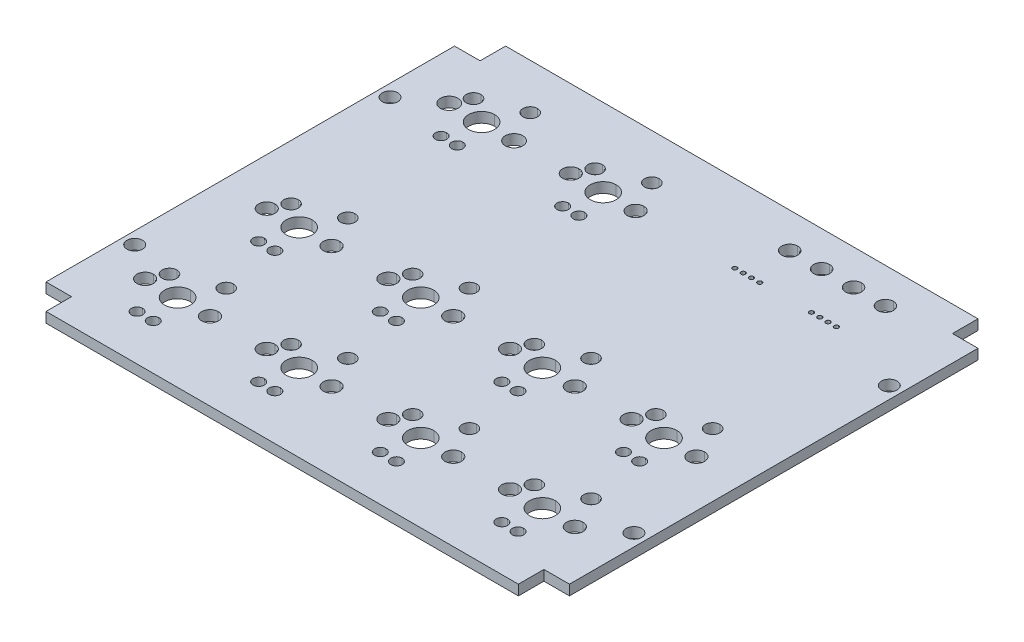
from build123d import *

# Parameters (mm, degrees)
BOSS_EXTRUDE1_DEPTH = 1.6
CUT_EXTRUDE1_DEPTH  = 55.585346019
SKETCH3_R           = 1.375
CUT_EXTRUDE2_DEPTH  = 55.585346163
SKETCH4_R           = 1.2192
CUT_EXTRUDE3_DEPTH  = 55.585346163


with BuildPart() as part:
    # Sketch1 → Boss-Extrude1 (new body)
    with BuildSketch(Plane(origin=(0, 0, 0), x_dir=(1, 0, 0), z_dir=(0, 1, 0))):
        Polygon((-41, 32), (-37, 32), (-37, 36), (37, 36), (37, 32), (41, 32), (41, -32), (37, -32), (37, -36), (-37, -36), (-37, -32), (-41, -32), align=None)
    extrude(amount=BOSS_EXTRUDE1_DEPTH)

    # Sketch2 → Cut-Extrude1 (cut, through all)
    with BuildSketch(Plane(origin=(0, 1.6, 0), x_dir=(1, 0, 0), z_dir=(0, 1, 0))):
        with BuildLine():
            add(Edge.make_bspline(
                [(-28.576104476, 21.781829786), (-29.698327994, 21.781829786), (-30.608099847, 22.691601639), (-30.608099847, 24.936048674), (-29.698327994, 25.845820527), (-28.576104476, 25.845820527)],
                knots=[2, 2, 2, 2, 3, 3, 4, 4, 4, 4], degree=3))
            add(Edge.make_bspline(
                [(-28.576104476, 25.845820527), (-27.453880959, 25.845820527), (-26.544109106, 24.936048674), (-26.544109106, 22.691601639), (-27.453880959, 21.781829786), (-28.576104476, 21.781829786)],
                knots=[0, 0, 0, 0, 1, 1, 2, 2, 2, 2], degree=3))
        make_face()
        with BuildLine():
            add(Edge.make_bspline(
                [(-9.526147876, 21.781829786), (-10.648433406, 21.781829786), (-11.558143247, 22.691601639), (-11.558143247, 24.936048674), (-10.648433406, 25.845820527), (-9.526147876, 25.845820527)],
                knots=[2, 2, 2, 2, 3, 3, 4, 4, 4, 4], degree=3))
            add(Edge.make_bspline(
                [(-9.526147876, 25.845820527), (-8.403862347, 25.845820527), (-7.494152506, 24.936048674), (-7.494152506, 22.691601639), (-8.403862347, 21.781829786), (-9.526147876, 21.781829786)],
                knots=[0, 0, 0, 0, 1, 1, 2, 2, 2, 2], degree=3))
        make_face()
        with BuildLine():
            add(Edge.make_bspline(
                [(-28.576104476, -6.794159311), (-29.698327994, -6.794159311), (-30.608099847, -5.884387458), (-30.608099847, -3.639940423), (-29.698327994, -2.73016857), (-28.576104476, -2.73016857)],
                knots=[2, 2, 2, 2, 3, 3, 4, 4, 4, 4], degree=3))
            add(Edge.make_bspline(
                [(-28.576104476, -2.73016857), (-27.453880959, -2.73016857), (-26.544109106, -3.639940423), (-26.544109106, -5.884387458), (-27.453880959, -6.794159311), (-28.576104476, -6.794159311)],
                knots=[0, 0, 0, 0, 1, 1, 2, 2, 2, 2], degree=3))
        make_face()
        with BuildLine():
            add(Edge.make_bspline(
                [(-9.526147876, -6.794159311), (-10.648433406, -6.794159311), (-11.558143247, -5.884387458), (-11.558143247, -3.639940423), (-10.648433406, -2.73016857), (-9.526147876, -2.73016857)],
                knots=[2, 2, 2, 2, 3, 3, 4, 4, 4, 4], degree=3))
            add(Edge.make_bspline(
                [(-9.526147876, -2.73016857), (-8.403862347, -2.73016857), (-7.494152506, -3.639940423), (-7.494152506, -5.884387458), (-8.403862347, -6.794159311), (-9.526147876, -6.794159311)],
                knots=[0, 0, 0, 0, 1, 1, 2, 2, 2, 2], degree=3))
        make_face()
        with BuildLine():
            add(Edge.make_bspline(
                [(9.523808723, -6.794159311), (8.401523194, -6.794159311), (7.491813353, -5.884387458), (7.491813353, -3.639940423), (8.401523194, -2.73016857), (9.523808723, -2.73016857)],
                knots=[2, 2, 2, 2, 3, 3, 4, 4, 4, 4], degree=3))
            add(Edge.make_bspline(
                [(9.523808723, -2.73016857), (10.646094253, -2.73016857), (11.555804094, -3.639940423), (11.555804094, -5.884387458), (10.646094253, -6.794159311), (9.523808723, -6.794159311)],
                knots=[0, 0, 0, 0, 1, 1, 2, 2, 2, 2], degree=3))
        make_face()
        with BuildLine():
            add(Edge.make_bspline(
                [(28.573765323, -6.794159311), (27.451479794, -6.794159311), (26.541769953, -5.884387458), (26.541769953, -3.639940423), (27.451479794, -2.73016857), (28.573765323, -2.73016857)],
                knots=[2, 2, 2, 2, 3, 3, 4, 4, 4, 4], degree=3))
            add(Edge.make_bspline(
                [(28.573765323, -2.73016857), (29.696050852, -2.73016857), (30.605760694, -3.639940423), (30.605760694, -5.884387458), (29.696050852, -6.794159311), (28.573765323, -6.794159311)],
                knots=[0, 0, 0, 0, 1, 1, 2, 2, 2, 2], degree=3))
        make_face()
        with BuildLine():
            add(Edge.make_bspline(
                [(-28.576104476, -25.844115911), (-29.698327994, -25.844115911), (-30.608099847, -24.934344058), (-30.608099847, -22.689897023), (-29.698327994, -21.78012517), (-28.576104476, -21.78012517)],
                knots=[2, 2, 2, 2, 3, 3, 4, 4, 4, 4], degree=3))
            add(Edge.make_bspline(
                [(-28.576104476, -21.78012517), (-27.453880959, -21.78012517), (-26.544109106, -22.689897023), (-26.544109106, -24.934344058), (-27.453880959, -25.844115911), (-28.576104476, -25.844115911)],
                knots=[0, 0, 0, 0, 1, 1, 2, 2, 2, 2], degree=3))
        make_face()
        with BuildLine():
            add(Edge.make_bspline(
                [(-9.526147876, -25.844115911), (-10.648433406, -25.844115911), (-11.558143247, -24.934344058), (-11.558143247, -22.689897023), (-10.648433406, -21.78012517), (-9.526147876, -21.78012517)],
                knots=[2, 2, 2, 2, 3, 3, 4, 4, 4, 4], degree=3))
            add(Edge.make_bspline(
                [(-9.526147876, -21.78012517), (-8.403862347, -21.78012517), (-7.494152506, -22.689897023), (-7.494152506, -24.934344058), (-8.403862347, -25.844115911), (-9.526147876, -25.844115911)],
                knots=[0, 0, 0, 0, 1, 1, 2, 2, 2, 2], degree=3))
        make_face()
        with BuildLine():
            add(Edge.make_bspline(
                [(9.523808723, -25.844115911), (8.401523194, -25.844115911), (7.491813353, -24.934344058), (7.491813353, -22.689897023), (8.401523194, -21.78012517), (9.523808723, -21.78012517)],
                knots=[2, 2, 2, 2, 3, 3, 4, 4, 4, 4], degree=3))
            add(Edge.make_bspline(
                [(9.523808723, -21.78012517), (10.646094253, -21.78012517), (11.555804094, -22.689897023), (11.555804094, -24.934344058), (10.646094253, -25.844115911), (9.523808723, -25.844115911)],
                knots=[0, 0, 0, 0, 1, 1, 2, 2, 2, 2], degree=3))
        make_face()
        with BuildLine():
            add(Edge.make_bspline(
                [(28.573765323, -25.844115911), (27.451479794, -25.844115911), (26.541769953, -24.934344058), (26.541769953, -22.689897023), (27.451479794, -21.78012517), (28.573765323, -21.78012517)],
                knots=[2, 2, 2, 2, 3, 3, 4, 4, 4, 4], degree=3))
            add(Edge.make_bspline(
                [(28.573765323, -21.78012517), (29.696050852, -21.78012517), (30.605760694, -22.689897023), (30.605760694, -24.934344058), (29.696050852, -25.844115911), (28.573765323, -25.844115911)],
                knots=[0, 0, 0, 0, 1, 1, 2, 2, 2, 2], degree=3))
        make_face()
        with BuildLine():
            add(Edge.make_bspline(
                [(12.999805687, 29.249884061), (12.309492807, 29.249884061), (11.749776308, 29.809476536), (11.749776308, 31.19022632), (12.309492807, 31.749818795), (12.999805687, 31.749818795)],
                knots=[2, 2, 2, 2, 3, 3, 4, 4, 4, 4], degree=3))
            add(Edge.make_bspline(
                [(12.999805687, 31.749818795), (13.690118568, 31.749818795), (14.249835066, 31.19022632), (14.249835066, 29.809476536), (13.690118568, 29.249884061), (12.999805687, 29.249884061)],
                knots=[0, 0, 0, 0, 1, 1, 2, 2, 2, 2], degree=3))
        make_face()
        with BuildLine():
            add(Edge.make_bspline(
                [(23.000040717, 29.249884061), (22.309727836, 29.249884061), (21.750011338, 29.809476536), (21.750011338, 31.19022632), (22.309727836, 31.749818795), (23.000040717, 31.749818795)],
                knots=[2, 2, 2, 2, 3, 3, 4, 4, 4, 4], degree=3))
            add(Edge.make_bspline(
                [(23.000040717, 31.749818795), (23.690353597, 31.749818795), (24.250070096, 31.19022632), (24.250070096, 29.809476536), (23.690353597, 29.249884061), (23.000040717, 29.249884061)],
                knots=[0, 0, 0, 0, 1, 1, 2, 2, 2, 2], degree=3))
        make_face()
        with BuildLine():
            add(Edge.make_bspline(
                [(27.999910185, 29.249884061), (27.309597305, 29.249884061), (26.749880807, 29.809476536), (26.749880807, 31.19022632), (27.309597305, 31.749818795), (27.999910185, 31.749818795)],
                knots=[2, 2, 2, 2, 3, 3, 4, 4, 4, 4], degree=3))
            add(Edge.make_bspline(
                [(27.999910185, 31.749818795), (28.690223066, 31.749818795), (29.249939564, 31.19022632), (29.249939564, 29.809476536), (28.690223066, 29.249884061), (27.999910185, 29.249884061)],
                knots=[0, 0, 0, 0, 1, 1, 2, 2, 2, 2], degree=3))
        make_face()
        with BuildLine():
            add(Edge.make_bspline(
                [(17.999799179, 29.249884061), (17.309486298, 29.249884061), (16.7497698, 29.809476536), (16.7497698, 31.19022632), (17.309486298, 31.749818795), (17.999799179, 31.749818795)],
                knots=[2, 2, 2, 2, 3, 3, 4, 4, 4, 4], degree=3))
            add(Edge.make_bspline(
                [(17.999799179, 31.749818795), (18.690112059, 31.749818795), (19.249828558, 31.19022632), (19.249828558, 29.809476536), (18.690112059, 29.249884061), (17.999799179, 29.249884061)],
                knots=[0, 0, 0, 0, 1, 1, 2, 2, 2, 2], degree=3))
        make_face()
        with BuildLine():
            add(Edge.make_bspline(
                [(-32.386095796, 25.210821974), (-33.017373655, 25.210821974), (-33.529093192, 25.722541511), (-33.529093192, 26.985097228), (-33.017373655, 27.496816766), (-32.386095796, 27.496816766)],
                knots=[2, 2, 2, 2, 3, 3, 4, 4, 4, 4], degree=3))
            add(Edge.make_bspline(
                [(-32.386095796, 27.496816766), (-31.754817938, 27.496816766), (-31.2430984, 26.985097228), (-31.2430984, 25.722541511), (-31.754817938, 25.210821974), (-32.386095796, 25.210821974)],
                knots=[0, 0, 0, 0, 1, 1, 2, 2, 2, 2], degree=3))
        make_face()
        with BuildLine():
            add(Edge.make_bspline(
                [(-26.036110263, 27.750816187), (-26.667388122, 27.750816187), (-27.179107659, 28.262535724), (-27.179107659, 29.525091442), (-26.667388122, 30.036810979), (-26.036110263, 30.036810979)],
                knots=[2, 2, 2, 2, 3, 3, 4, 4, 4, 4], degree=3))
            add(Edge.make_bspline(
                [(-26.036110263, 30.036810979), (-25.404832404, 30.036810979), (-24.893112867, 29.525091442), (-24.893112867, 28.262535724), (-25.404832404, 27.750816187), (-26.036110263, 27.750816187)],
                knots=[0, 0, 0, 0, 1, 1, 2, 2, 2, 2], degree=3))
        make_face()
        with BuildLine():
            add(Edge.make_bspline(
                [(-33.656092903, 22.528077109), (-34.366187477, 22.528077109), (-34.94184095, 23.103730583), (-34.94184095, 24.52391973), (-34.366187477, 25.099573204), (-33.656092903, 25.099573204)],
                knots=[2, 2, 2, 2, 3, 3, 4, 4, 4, 4], degree=3))
            add(Edge.make_bspline(
                [(-33.656092903, 25.099573204), (-32.945998329, 25.099573204), (-32.370344856, 24.52391973), (-32.370344856, 23.103730583), (-32.945998329, 22.528077109), (-33.656092903, 22.528077109)],
                knots=[0, 0, 0, 0, 1, 1, 2, 2, 2, 2], degree=3))
        make_face()
        with BuildLine():
            add(Edge.make_bspline(
                [(-23.49611605, 22.528077109), (-24.206210623, 22.528077109), (-24.781864097, 23.103730583), (-24.781864097, 24.52391973), (-24.206210623, 25.099573204), (-23.49611605, 25.099573204)],
                knots=[2, 2, 2, 2, 3, 3, 4, 4, 4, 4], degree=3))
            add(Edge.make_bspline(
                [(-23.49611605, 25.099573204), (-22.786021476, 25.099573204), (-22.210368002, 24.52391973), (-22.210368002, 23.103730583), (-22.786021476, 22.528077109), (-23.49611605, 22.528077109)],
                knots=[0, 0, 0, 0, 1, 1, 2, 2, 2, 2], degree=3))
        make_face()
        with BuildLine():
            add(Edge.make_bspline(
                [(-29.846101583, 17.844838755), (-30.337109253, 17.844838755), (-30.735099558, 18.242829059), (-30.735099558, 19.2248444), (-30.337109253, 19.622834704), (-29.846101583, 19.622834704)],
                knots=[2, 2, 2, 2, 3, 3, 4, 4, 4, 4], degree=3))
            add(Edge.make_bspline(
                [(-29.846101583, 19.622834704), (-29.355093913, 19.622834704), (-28.957103608, 19.2248444), (-28.957103608, 18.242829059), (-29.355093913, 17.844838755), (-29.846101583, 17.844838755)],
                knots=[0, 0, 0, 0, 1, 1, 2, 2, 2, 2], degree=3))
        make_face()
        with BuildLine():
            add(Edge.make_bspline(
                [(-27.30610737, 17.844838755), (-27.79711504, 17.844838755), (-28.195105344, 18.242829059), (-28.195105344, 19.2248444), (-27.79711504, 19.622834704), (-27.30610737, 19.622834704)],
                knots=[2, 2, 2, 2, 3, 3, 4, 4, 4, 4], degree=3))
            add(Edge.make_bspline(
                [(-27.30610737, 19.622834704), (-26.815099699, 19.622834704), (-26.417109395, 19.2248444), (-26.417109395, 18.242829059), (-26.815099699, 17.844838755), (-27.30610737, 17.844838755)],
                knots=[0, 0, 0, 0, 1, 1, 2, 2, 2, 2], degree=3))
        make_face()
        with BuildLine():
            add(Edge.make_bspline(
                [(-13.336139196, 25.210821974), (-13.967417055, 25.210821974), (-14.479136592, 25.722541511), (-14.479136592, 26.985097228), (-13.967417055, 27.496816766), (-13.336139196, 27.496816766)],
                knots=[2, 2, 2, 2, 3, 3, 4, 4, 4, 4], degree=3))
            add(Edge.make_bspline(
                [(-13.336139196, 27.496816766), (-12.704861338, 27.496816766), (-12.1931418, 26.985097228), (-12.1931418, 25.722541511), (-12.704861338, 25.210821974), (-13.336139196, 25.210821974)],
                knots=[0, 0, 0, 0, 1, 1, 2, 2, 2, 2], degree=3))
        make_face()
        with BuildLine():
            add(Edge.make_bspline(
                [(-6.986153663, 27.750816187), (-7.617431522, 27.750816187), (-8.129151059, 28.262535724), (-8.129151059, 29.525091442), (-7.617431522, 30.036810979), (-6.986153663, 30.036810979)],
                knots=[2, 2, 2, 2, 3, 3, 4, 4, 4, 4], degree=3))
            add(Edge.make_bspline(
                [(-6.986153663, 30.036810979), (-6.354875804, 30.036810979), (-5.843156267, 29.525091442), (-5.843156267, 28.262535724), (-6.354875804, 27.750816187), (-6.986153663, 27.750816187)],
                knots=[0, 0, 0, 0, 1, 1, 2, 2, 2, 2], degree=3))
        make_face()
        with BuildLine():
            add(Edge.make_bspline(
                [(-14.606136303, 22.528077109), (-15.316292888, 22.528077109), (-15.89188435, 23.103730583), (-15.89188435, 24.52391973), (-15.316292888, 25.099573204), (-14.606136303, 25.099573204)],
                knots=[2, 2, 2, 2, 3, 3, 4, 4, 4, 4], degree=3))
            add(Edge.make_bspline(
                [(-14.606136303, 25.099573204), (-13.895979718, 25.099573204), (-13.320388256, 24.52391973), (-13.320388256, 23.103730583), (-13.895979718, 22.528077109), (-14.606136303, 22.528077109)],
                knots=[0, 0, 0, 0, 1, 1, 2, 2, 2, 2], degree=3))
        make_face()
        with BuildLine():
            add(Edge.make_bspline(
                [(-4.44615945, 22.528077109), (-5.156316035, 22.528077109), (-5.731907497, 23.103730583), (-5.731907497, 24.52391973), (-5.156316035, 25.099573204), (-4.44615945, 25.099573204)],
                knots=[2, 2, 2, 2, 3, 3, 4, 4, 4, 4], degree=3))
            add(Edge.make_bspline(
                [(-4.44615945, 25.099573204), (-3.736002865, 25.099573204), (-3.160411402, 24.52391973), (-3.160411402, 23.103730583), (-3.736002865, 22.528077109), (-4.44615945, 22.528077109)],
                knots=[0, 0, 0, 0, 1, 1, 2, 2, 2, 2], degree=3))
        make_face()
        with BuildLine():
            add(Edge.make_bspline(
                [(-10.796144983, 17.844838755), (-11.287152654, 17.844838755), (-11.685142958, 18.242829059), (-11.685142958, 19.2248444), (-11.287152654, 19.622834704), (-10.796144983, 19.622834704)],
                knots=[2, 2, 2, 2, 3, 3, 4, 4, 4, 4], degree=3))
            add(Edge.make_bspline(
                [(-10.796144983, 19.622834704), (-10.305137313, 19.622834704), (-9.907147008, 19.2248444), (-9.907147008, 18.242829059), (-10.305137313, 17.844838755), (-10.796144983, 17.844838755)],
                knots=[0, 0, 0, 0, 1, 1, 2, 2, 2, 2], degree=3))
        make_face()
        with BuildLine():
            add(Edge.make_bspline(
                [(-8.25615077, 17.844838755), (-8.74715844, 17.844838755), (-9.145148744, 18.242829059), (-9.145148744, 19.2248444), (-8.74715844, 19.622834704), (-8.25615077, 19.622834704)],
                knots=[2, 2, 2, 2, 3, 3, 4, 4, 4, 4], degree=3))
            add(Edge.make_bspline(
                [(-8.25615077, 19.622834704), (-7.765143099, 19.622834704), (-7.367152795, 19.2248444), (-7.367152795, 18.242829059), (-7.765143099, 17.844838755), (-8.25615077, 17.844838755)],
                knots=[0, 0, 0, 0, 1, 1, 2, 2, 2, 2], degree=3))
        make_face()
        with BuildLine():
            add(Edge.make_bspline(
                [(-32.386095796, -3.365167123), (-33.017373655, -3.365167123), (-33.529093192, -2.853447586), (-33.529093192, -1.590891868), (-33.017373655, -1.079172331), (-32.386095796, -1.079172331)],
                knots=[2, 2, 2, 2, 3, 3, 4, 4, 4, 4], degree=3))
            add(Edge.make_bspline(
                [(-32.386095796, -1.079172331), (-31.754817938, -1.079172331), (-31.2430984, -1.590891868), (-31.2430984, -2.853447586), (-31.754817938, -3.365167123), (-32.386095796, -3.365167123)],
                knots=[0, 0, 0, 0, 1, 1, 2, 2, 2, 2], degree=3))
        make_face()
        with BuildLine():
            add(Edge.make_bspline(
                [(-26.036110263, -0.82517291), (-26.667388122, -0.82517291), (-27.179107659, -0.313453372), (-27.179107659, 0.949102345), (-26.667388122, 1.460821882), (-26.036110263, 1.460821882)],
                knots=[2, 2, 2, 2, 3, 3, 4, 4, 4, 4], degree=3))
            add(Edge.make_bspline(
                [(-26.036110263, 1.460821882), (-25.404832404, 1.460821882), (-24.893112867, 0.949102345), (-24.893112867, -0.313453372), (-25.404832404, -0.82517291), (-26.036110263, -0.82517291)],
                knots=[0, 0, 0, 0, 1, 1, 2, 2, 2, 2], degree=3))
        make_face()
        with BuildLine():
            add(Edge.make_bspline(
                [(-33.656092903, -6.047911988), (-34.366187477, -6.047911988), (-34.94184095, -5.472258514), (-34.94184095, -4.052069367), (-34.366187477, -3.476415893), (-33.656092903, -3.476415893)],
                knots=[2, 2, 2, 2, 3, 3, 4, 4, 4, 4], degree=3))
            add(Edge.make_bspline(
                [(-33.656092903, -3.476415893), (-32.945998329, -3.476415893), (-32.370344856, -4.052069367), (-32.370344856, -5.472258514), (-32.945998329, -6.047911988), (-33.656092903, -6.047911988)],
                knots=[0, 0, 0, 0, 1, 1, 2, 2, 2, 2], degree=3))
        make_face()
        with BuildLine():
            add(Edge.make_bspline(
                [(-23.49611605, -6.047911988), (-24.206210623, -6.047911988), (-24.781864097, -5.472258514), (-24.781864097, -4.052069367), (-24.206210623, -3.476415893), (-23.49611605, -3.476415893)],
                knots=[2, 2, 2, 2, 3, 3, 4, 4, 4, 4], degree=3))
            add(Edge.make_bspline(
                [(-23.49611605, -3.476415893), (-22.786021476, -3.476415893), (-22.210368002, -4.052069367), (-22.210368002, -5.472258514), (-22.786021476, -6.047911988), (-23.49611605, -6.047911988)],
                knots=[0, 0, 0, 0, 1, 1, 2, 2, 2, 2], degree=3))
        make_face()
        with BuildLine():
            add(Edge.make_bspline(
                [(-29.846101583, -10.731150342), (-30.337109253, -10.731150342), (-30.735099558, -10.333160037), (-30.735099558, -9.351144697), (-30.337109253, -8.953154392), (-29.846101583, -8.953154392)],
                knots=[2, 2, 2, 2, 3, 3, 4, 4, 4, 4], degree=3))
            add(Edge.make_bspline(
                [(-29.846101583, -8.953154392), (-29.355093913, -8.953154392), (-28.957103608, -9.351144697), (-28.957103608, -10.333160037), (-29.355093913, -10.731150342), (-29.846101583, -10.731150342)],
                knots=[0, 0, 0, 0, 1, 1, 2, 2, 2, 2], degree=3))
        make_face()
        with BuildLine():
            add(Edge.make_bspline(
                [(-27.30610737, -10.731150342), (-27.79711504, -10.731150342), (-28.195105344, -10.333160037), (-28.195105344, -9.351144697), (-27.79711504, -8.953154392), (-27.30610737, -8.953154392)],
                knots=[2, 2, 2, 2, 3, 3, 4, 4, 4, 4], degree=3))
            add(Edge.make_bspline(
                [(-27.30610737, -8.953154392), (-26.815099699, -8.953154392), (-26.417109395, -9.351144697), (-26.417109395, -10.333160037), (-26.815099699, -10.731150342), (-27.30610737, -10.731150342)],
                knots=[0, 0, 0, 0, 1, 1, 2, 2, 2, 2], degree=3))
        make_face()
        with BuildLine():
            add(Edge.make_bspline(
                [(-13.336139196, -3.365167123), (-13.967417055, -3.365167123), (-14.479136592, -2.853447586), (-14.479136592, -1.590891868), (-13.967417055, -1.079172331), (-13.336139196, -1.079172331)],
                knots=[2, 2, 2, 2, 3, 3, 4, 4, 4, 4], degree=3))
            add(Edge.make_bspline(
                [(-13.336139196, -1.079172331), (-12.704861338, -1.079172331), (-12.1931418, -1.590891868), (-12.1931418, -2.853447586), (-12.704861338, -3.365167123), (-13.336139196, -3.365167123)],
                knots=[0, 0, 0, 0, 1, 1, 2, 2, 2, 2], degree=3))
        make_face()
        with BuildLine():
            add(Edge.make_bspline(
                [(-6.986153663, -0.82517291), (-7.617431522, -0.82517291), (-8.129151059, -0.313453372), (-8.129151059, 0.949102345), (-7.617431522, 1.460821882), (-6.986153663, 1.460821882)],
                knots=[2, 2, 2, 2, 3, 3, 4, 4, 4, 4], degree=3))
            add(Edge.make_bspline(
                [(-6.986153663, 1.460821882), (-6.354875804, 1.460821882), (-5.843156267, 0.949102345), (-5.843156267, -0.313453372), (-6.354875804, -0.82517291), (-6.986153663, -0.82517291)],
                knots=[0, 0, 0, 0, 1, 1, 2, 2, 2, 2], degree=3))
        make_face()
        with BuildLine():
            add(Edge.make_bspline(
                [(-14.606136303, -6.047911988), (-15.316292888, -6.047911988), (-15.89188435, -5.472258514), (-15.89188435, -4.052069367), (-15.316292888, -3.476415893), (-14.606136303, -3.476415893)],
                knots=[2, 2, 2, 2, 3, 3, 4, 4, 4, 4], degree=3))
            add(Edge.make_bspline(
                [(-14.606136303, -3.476415893), (-13.895979718, -3.476415893), (-13.320388256, -4.052069367), (-13.320388256, -5.472258514), (-13.895979718, -6.047911988), (-14.606136303, -6.047911988)],
                knots=[0, 0, 0, 0, 1, 1, 2, 2, 2, 2], degree=3))
        make_face()
        with BuildLine():
            add(Edge.make_bspline(
                [(-4.44615945, -6.047911988), (-5.156316035, -6.047911988), (-5.731907497, -5.472258514), (-5.731907497, -4.052069367), (-5.156316035, -3.476415893), (-4.44615945, -3.476415893)],
                knots=[2, 2, 2, 2, 3, 3, 4, 4, 4, 4], degree=3))
            add(Edge.make_bspline(
                [(-4.44615945, -3.476415893), (-3.736002865, -3.476415893), (-3.160411402, -4.052069367), (-3.160411402, -5.472258514), (-3.736002865, -6.047911988), (-4.44615945, -6.047911988)],
                knots=[0, 0, 0, 0, 1, 1, 2, 2, 2, 2], degree=3))
        make_face()
        with BuildLine():
            add(Edge.make_bspline(
                [(-10.796144983, -10.731150342), (-11.287152654, -10.731150342), (-11.685142958, -10.333160037), (-11.685142958, -9.351144697), (-11.287152654, -8.953154392), (-10.796144983, -8.953154392)],
                knots=[2, 2, 2, 2, 3, 3, 4, 4, 4, 4], degree=3))
            add(Edge.make_bspline(
                [(-10.796144983, -8.953154392), (-10.305137313, -8.953154392), (-9.907147008, -9.351144697), (-9.907147008, -10.333160037), (-10.305137313, -10.731150342), (-10.796144983, -10.731150342)],
                knots=[0, 0, 0, 0, 1, 1, 2, 2, 2, 2], degree=3))
        make_face()
        with BuildLine():
            add(Edge.make_bspline(
                [(-8.25615077, -10.731150342), (-8.74715844, -10.731150342), (-9.145148744, -10.333160037), (-9.145148744, -9.351144697), (-8.74715844, -8.953154392), (-8.25615077, -8.953154392)],
                knots=[2, 2, 2, 2, 3, 3, 4, 4, 4, 4], degree=3))
            add(Edge.make_bspline(
                [(-8.25615077, -8.953154392), (-7.765143099, -8.953154392), (-7.367152795, -9.351144697), (-7.367152795, -10.333160037), (-7.765143099, -10.731150342), (-8.25615077, -10.731150342)],
                knots=[0, 0, 0, 0, 1, 1, 2, 2, 2, 2], degree=3))
        make_face()
        with BuildLine():
            add(Edge.make_bspline(
                [(5.713817403, -3.365167123), (5.082539545, -3.365167123), (4.570820007, -2.853447586), (4.570820007, -1.590891868), (5.082539545, -1.079172331), (5.713817403, -1.079172331)],
                knots=[2, 2, 2, 2, 3, 3, 4, 4, 4, 4], degree=3))
            add(Edge.make_bspline(
                [(5.713817403, -1.079172331), (6.345095262, -1.079172331), (6.856814799, -1.590891868), (6.856814799, -2.853447586), (6.345095262, -3.365167123), (5.713817403, -3.365167123)],
                knots=[0, 0, 0, 0, 1, 1, 2, 2, 2, 2], degree=3))
        make_face()
        with BuildLine():
            add(Edge.make_bspline(
                [(12.063802937, -0.82517291), (11.432525078, -0.82517291), (10.920805541, -0.313453372), (10.920805541, 0.949102345), (11.432525078, 1.460821882), (12.063802937, 1.460821882)],
                knots=[2, 2, 2, 2, 3, 3, 4, 4, 4, 4], degree=3))
            add(Edge.make_bspline(
                [(12.063802937, 1.460821882), (12.695080795, 1.460821882), (13.206800333, 0.949102345), (13.206800333, -0.313453372), (12.695080795, -0.82517291), (12.063802937, -0.82517291)],
                knots=[0, 0, 0, 0, 1, 1, 2, 2, 2, 2], degree=3))
        make_face()
        with BuildLine():
            add(Edge.make_bspline(
                [(4.443820297, -6.047911988), (3.733663712, -6.047911988), (3.158072249, -5.472258514), (3.158072249, -4.052069367), (3.733663712, -3.476415893), (4.443820297, -3.476415893)],
                knots=[2, 2, 2, 2, 3, 3, 4, 4, 4, 4], degree=3))
            add(Edge.make_bspline(
                [(4.443820297, -3.476415893), (5.153976882, -3.476415893), (5.729568344, -4.052069367), (5.729568344, -5.472258514), (5.153976882, -6.047911988), (4.443820297, -6.047911988)],
                knots=[0, 0, 0, 0, 1, 1, 2, 2, 2, 2], degree=3))
        make_face()
        with BuildLine():
            add(Edge.make_bspline(
                [(14.60379715, -6.047911988), (13.893640565, -6.047911988), (13.318049103, -5.472258514), (13.318049103, -4.052069367), (13.893640565, -3.476415893), (14.60379715, -3.476415893)],
                knots=[2, 2, 2, 2, 3, 3, 4, 4, 4, 4], degree=3))
            add(Edge.make_bspline(
                [(14.60379715, -3.476415893), (15.313953735, -3.476415893), (15.889545197, -4.052069367), (15.889545197, -5.472258514), (15.313953735, -6.047911988), (14.60379715, -6.047911988)],
                knots=[0, 0, 0, 0, 1, 1, 2, 2, 2, 2], degree=3))
        make_face()
        with BuildLine():
            add(Edge.make_bspline(
                [(8.253811617, -10.731150342), (7.762803946, -10.731150342), (7.364813642, -10.333160037), (7.364813642, -9.351144697), (7.762803946, -8.953154392), (8.253811617, -8.953154392)],
                knots=[2, 2, 2, 2, 3, 3, 4, 4, 4, 4], degree=3))
            add(Edge.make_bspline(
                [(8.253811617, -8.953154392), (8.744819287, -8.953154392), (9.142809591, -9.351144697), (9.142809591, -10.333160037), (8.744819287, -10.731150342), (8.253811617, -10.731150342)],
                knots=[0, 0, 0, 0, 1, 1, 2, 2, 2, 2], degree=3))
        make_face()
        with BuildLine():
            add(Edge.make_bspline(
                [(10.79380583, -10.731150342), (10.30279816, -10.731150342), (9.904807855, -10.333160037), (9.904807855, -9.351144697), (10.30279816, -8.953154392), (10.79380583, -8.953154392)],
                knots=[2, 2, 2, 2, 3, 3, 4, 4, 4, 4], degree=3))
            add(Edge.make_bspline(
                [(10.79380583, -8.953154392), (11.284813501, -8.953154392), (11.682803805, -9.351144697), (11.682803805, -10.333160037), (11.284813501, -10.731150342), (10.79380583, -10.731150342)],
                knots=[0, 0, 0, 0, 1, 1, 2, 2, 2, 2], degree=3))
        make_face()
        with BuildLine():
            add(Edge.make_bspline(
                [(24.763774003, -3.365167123), (24.132496145, -3.365167123), (23.620776607, -2.853447586), (23.620776607, -1.590891868), (24.132496145, -1.079172331), (24.763774003, -1.079172331)],
                knots=[2, 2, 2, 2, 3, 3, 4, 4, 4, 4], degree=3))
            add(Edge.make_bspline(
                [(24.763774003, -1.079172331), (25.395051862, -1.079172331), (25.906771399, -1.590891868), (25.906771399, -2.853447586), (25.395051862, -3.365167123), (24.763774003, -3.365167123)],
                knots=[0, 0, 0, 0, 1, 1, 2, 2, 2, 2], degree=3))
        make_face()
        with BuildLine():
            add(Edge.make_bspline(
                [(31.113759537, -0.82517291), (30.482481678, -0.82517291), (29.970762141, -0.313453372), (29.970762141, 0.949102345), (30.482481678, 1.460821882), (31.113759537, 1.460821882)],
                knots=[2, 2, 2, 2, 3, 3, 4, 4, 4, 4], degree=3))
            add(Edge.make_bspline(
                [(31.113759537, 1.460821882), (31.745037395, 1.460821882), (32.256756933, 0.949102345), (32.256756933, -0.313453372), (31.745037395, -0.82517291), (31.113759537, -0.82517291)],
                knots=[0, 0, 0, 0, 1, 1, 2, 2, 2, 2], degree=3))
        make_face()
        with BuildLine():
            add(Edge.make_bspline(
                [(23.493776897, -6.047911988), (22.783620311, -6.047911988), (22.208028849, -5.472258514), (22.208028849, -4.052069367), (22.783620311, -3.476415893), (23.493776897, -3.476415893)],
                knots=[2, 2, 2, 2, 3, 3, 4, 4, 4, 4], degree=3))
            add(Edge.make_bspline(
                [(23.493776897, -3.476415893), (24.203933482, -3.476415893), (24.779524944, -4.052069367), (24.779524944, -5.472258514), (24.203933482, -6.047911988), (23.493776897, -6.047911988)],
                knots=[0, 0, 0, 0, 1, 1, 2, 2, 2, 2], degree=3))
        make_face()
        with BuildLine():
            add(Edge.make_bspline(
                [(33.65375375, -6.047911988), (32.943597165, -6.047911988), (32.368005703, -5.472258514), (32.368005703, -4.052069367), (32.943597165, -3.476415893), (33.65375375, -3.476415893)],
                knots=[2, 2, 2, 2, 3, 3, 4, 4, 4, 4], degree=3))
            add(Edge.make_bspline(
                [(33.65375375, -3.476415893), (34.363910335, -3.476415893), (34.939501797, -4.052069367), (34.939501797, -5.472258514), (34.363910335, -6.047911988), (33.65375375, -6.047911988)],
                knots=[0, 0, 0, 0, 1, 1, 2, 2, 2, 2], degree=3))
        make_face()
        with BuildLine():
            add(Edge.make_bspline(
                [(27.303768217, -10.731150342), (26.812760546, -10.731150342), (26.414770242, -10.333160037), (26.414770242, -9.351144697), (26.812760546, -8.953154392), (27.303768217, -8.953154392)],
                knots=[2, 2, 2, 2, 3, 3, 4, 4, 4, 4], degree=3))
            add(Edge.make_bspline(
                [(27.303768217, -8.953154392), (27.794775887, -8.953154392), (28.192766191, -9.351144697), (28.192766191, -10.333160037), (27.794775887, -10.731150342), (27.303768217, -10.731150342)],
                knots=[0, 0, 0, 0, 1, 1, 2, 2, 2, 2], degree=3))
        make_face()
        with BuildLine():
            add(Edge.make_bspline(
                [(29.84376243, -10.731150342), (29.35275476, -10.731150342), (28.954764455, -10.333160037), (28.954764455, -9.351144697), (29.35275476, -8.953154392), (29.84376243, -8.953154392)],
                knots=[2, 2, 2, 2, 3, 3, 4, 4, 4, 4], degree=3))
            add(Edge.make_bspline(
                [(29.84376243, -8.953154392), (30.3347701, -8.953154392), (30.732760405, -9.351144697), (30.732760405, -10.333160037), (30.3347701, -10.731150342), (29.84376243, -10.731150342)],
                knots=[0, 0, 0, 0, 1, 1, 2, 2, 2, 2], degree=3))
        make_face()
        with BuildLine():
            add(Edge.make_bspline(
                [(-32.386095796, -22.415123723), (-33.017373655, -22.415123723), (-33.529093192, -21.903404186), (-33.529093192, -20.640848468), (-33.017373655, -20.129128931), (-32.386095796, -20.129128931)],
                knots=[2, 2, 2, 2, 3, 3, 4, 4, 4, 4], degree=3))
            add(Edge.make_bspline(
                [(-32.386095796, -20.129128931), (-31.754817938, -20.129128931), (-31.2430984, -20.640848468), (-31.2430984, -21.903404186), (-31.754817938, -22.415123723), (-32.386095796, -22.415123723)],
                knots=[0, 0, 0, 0, 1, 1, 2, 2, 2, 2], degree=3))
        make_face()
        with BuildLine():
            add(Edge.make_bspline(
                [(-26.036110263, -19.87512951), (-26.667388122, -19.87512951), (-27.179107659, -19.363409972), (-27.179107659, -18.100854255), (-26.667388122, -17.589134718), (-26.036110263, -17.589134718)],
                knots=[2, 2, 2, 2, 3, 3, 4, 4, 4, 4], degree=3))
            add(Edge.make_bspline(
                [(-26.036110263, -17.589134718), (-25.404832404, -17.589134718), (-24.893112867, -18.100854255), (-24.893112867, -19.363409972), (-25.404832404, -19.87512951), (-26.036110263, -19.87512951)],
                knots=[0, 0, 0, 0, 1, 1, 2, 2, 2, 2], degree=3))
        make_face()
        with BuildLine():
            add(Edge.make_bspline(
                [(-33.656092903, -25.097868588), (-34.366187477, -25.097868588), (-34.94184095, -24.522215114), (-34.94184095, -23.102025967), (-34.366187477, -22.526372493), (-33.656092903, -22.526372493)],
                knots=[2, 2, 2, 2, 3, 3, 4, 4, 4, 4], degree=3))
            add(Edge.make_bspline(
                [(-33.656092903, -22.526372493), (-32.945998329, -22.526372493), (-32.370344856, -23.102025967), (-32.370344856, -24.522215114), (-32.945998329, -25.097868588), (-33.656092903, -25.097868588)],
                knots=[0, 0, 0, 0, 1, 1, 2, 2, 2, 2], degree=3))
        make_face()
        with BuildLine():
            add(Edge.make_bspline(
                [(-23.49611605, -25.097868588), (-24.206210623, -25.097868588), (-24.781864097, -24.522215114), (-24.781864097, -23.102025967), (-24.206210623, -22.526372493), (-23.49611605, -22.526372493)],
                knots=[2, 2, 2, 2, 3, 3, 4, 4, 4, 4], degree=3))
            add(Edge.make_bspline(
                [(-23.49611605, -22.526372493), (-22.786021476, -22.526372493), (-22.210368002, -23.102025967), (-22.210368002, -24.522215114), (-22.786021476, -25.097868588), (-23.49611605, -25.097868588)],
                knots=[0, 0, 0, 0, 1, 1, 2, 2, 2, 2], degree=3))
        make_face()
        with BuildLine():
            add(Edge.make_bspline(
                [(-29.846101583, -29.781106941), (-30.337109253, -29.781106941), (-30.735099558, -29.383116637), (-30.735099558, -28.401101296), (-30.337109253, -28.003110992), (-29.846101583, -28.003110992)],
                knots=[2, 2, 2, 2, 3, 3, 4, 4, 4, 4], degree=3))
            add(Edge.make_bspline(
                [(-29.846101583, -28.003110992), (-29.355093913, -28.003110992), (-28.957103608, -28.401101296), (-28.957103608, -29.383116637), (-29.355093913, -29.781106941), (-29.846101583, -29.781106941)],
                knots=[0, 0, 0, 0, 1, 1, 2, 2, 2, 2], degree=3))
        make_face()
        with BuildLine():
            add(Edge.make_bspline(
                [(-27.30610737, -29.781106941), (-27.79711504, -29.781106941), (-28.195105344, -29.383116637), (-28.195105344, -28.401101296), (-27.79711504, -28.003110992), (-27.30610737, -28.003110992)],
                knots=[2, 2, 2, 2, 3, 3, 4, 4, 4, 4], degree=3))
            add(Edge.make_bspline(
                [(-27.30610737, -28.003110992), (-26.815099699, -28.003110992), (-26.417109395, -28.401101296), (-26.417109395, -29.383116637), (-26.815099699, -29.781106941), (-27.30610737, -29.781106941)],
                knots=[0, 0, 0, 0, 1, 1, 2, 2, 2, 2], degree=3))
        make_face()
        with BuildLine():
            add(Edge.make_bspline(
                [(-13.336139196, -22.415123723), (-13.967417055, -22.415123723), (-14.479136592, -21.903404186), (-14.479136592, -20.640848468), (-13.967417055, -20.129128931), (-13.336139196, -20.129128931)],
                knots=[2, 2, 2, 2, 3, 3, 4, 4, 4, 4], degree=3))
            add(Edge.make_bspline(
                [(-13.336139196, -20.129128931), (-12.704861338, -20.129128931), (-12.1931418, -20.640848468), (-12.1931418, -21.903404186), (-12.704861338, -22.415123723), (-13.336139196, -22.415123723)],
                knots=[0, 0, 0, 0, 1, 1, 2, 2, 2, 2], degree=3))
        make_face()
        with BuildLine():
            add(Edge.make_bspline(
                [(-6.986153663, -19.87512951), (-7.617431522, -19.87512951), (-8.129151059, -19.363409972), (-8.129151059, -18.100854255), (-7.617431522, -17.589134718), (-6.986153663, -17.589134718)],
                knots=[2, 2, 2, 2, 3, 3, 4, 4, 4, 4], degree=3))
            add(Edge.make_bspline(
                [(-6.986153663, -17.589134718), (-6.354875804, -17.589134718), (-5.843156267, -18.100854255), (-5.843156267, -19.363409972), (-6.354875804, -19.87512951), (-6.986153663, -19.87512951)],
                knots=[0, 0, 0, 0, 1, 1, 2, 2, 2, 2], degree=3))
        make_face()
        with BuildLine():
            add(Edge.make_bspline(
                [(-14.606136303, -25.097868588), (-15.316292888, -25.097868588), (-15.89188435, -24.522215114), (-15.89188435, -23.102025967), (-15.316292888, -22.526372493), (-14.606136303, -22.526372493)],
                knots=[2, 2, 2, 2, 3, 3, 4, 4, 4, 4], degree=3))
            add(Edge.make_bspline(
                [(-14.606136303, -22.526372493), (-13.895979718, -22.526372493), (-13.320388256, -23.102025967), (-13.320388256, -24.522215114), (-13.895979718, -25.097868588), (-14.606136303, -25.097868588)],
                knots=[0, 0, 0, 0, 1, 1, 2, 2, 2, 2], degree=3))
        make_face()
        with BuildLine():
            add(Edge.make_bspline(
                [(-4.44615945, -25.097868588), (-5.156316035, -25.097868588), (-5.731907497, -24.522215114), (-5.731907497, -23.102025967), (-5.156316035, -22.526372493), (-4.44615945, -22.526372493)],
                knots=[2, 2, 2, 2, 3, 3, 4, 4, 4, 4], degree=3))
            add(Edge.make_bspline(
                [(-4.44615945, -22.526372493), (-3.736002865, -22.526372493), (-3.160411402, -23.102025967), (-3.160411402, -24.522215114), (-3.736002865, -25.097868588), (-4.44615945, -25.097868588)],
                knots=[0, 0, 0, 0, 1, 1, 2, 2, 2, 2], degree=3))
        make_face()
        with BuildLine():
            add(Edge.make_bspline(
                [(-10.796144983, -29.781106941), (-11.287152654, -29.781106941), (-11.685142958, -29.383116637), (-11.685142958, -28.401101296), (-11.287152654, -28.003110992), (-10.796144983, -28.003110992)],
                knots=[2, 2, 2, 2, 3, 3, 4, 4, 4, 4], degree=3))
            add(Edge.make_bspline(
                [(-10.796144983, -28.003110992), (-10.305137313, -28.003110992), (-9.907147008, -28.401101296), (-9.907147008, -29.383116637), (-10.305137313, -29.781106941), (-10.796144983, -29.781106941)],
                knots=[0, 0, 0, 0, 1, 1, 2, 2, 2, 2], degree=3))
        make_face()
        with BuildLine():
            add(Edge.make_bspline(
                [(-8.25615077, -29.781106941), (-8.74715844, -29.781106941), (-9.145148744, -29.383116637), (-9.145148744, -28.401101296), (-8.74715844, -28.003110992), (-8.25615077, -28.003110992)],
                knots=[2, 2, 2, 2, 3, 3, 4, 4, 4, 4], degree=3))
            add(Edge.make_bspline(
                [(-8.25615077, -28.003110992), (-7.765143099, -28.003110992), (-7.367152795, -28.401101296), (-7.367152795, -29.383116637), (-7.765143099, -29.781106941), (-8.25615077, -29.781106941)],
                knots=[0, 0, 0, 0, 1, 1, 2, 2, 2, 2], degree=3))
        make_face()
        with BuildLine():
            add(Edge.make_bspline(
                [(5.713817403, -22.415123723), (5.082539545, -22.415123723), (4.570820007, -21.903404186), (4.570820007, -20.640848468), (5.082539545, -20.129128931), (5.713817403, -20.129128931)],
                knots=[2, 2, 2, 2, 3, 3, 4, 4, 4, 4], degree=3))
            add(Edge.make_bspline(
                [(5.713817403, -20.129128931), (6.345095262, -20.129128931), (6.856814799, -20.640848468), (6.856814799, -21.903404186), (6.345095262, -22.415123723), (5.713817403, -22.415123723)],
                knots=[0, 0, 0, 0, 1, 1, 2, 2, 2, 2], degree=3))
        make_face()
        with BuildLine():
            add(Edge.make_bspline(
                [(12.063802937, -19.87512951), (11.432525078, -19.87512951), (10.920805541, -19.363409972), (10.920805541, -18.100854255), (11.432525078, -17.589134718), (12.063802937, -17.589134718)],
                knots=[2, 2, 2, 2, 3, 3, 4, 4, 4, 4], degree=3))
            add(Edge.make_bspline(
                [(12.063802937, -17.589134718), (12.695080795, -17.589134718), (13.206800333, -18.100854255), (13.206800333, -19.363409972), (12.695080795, -19.87512951), (12.063802937, -19.87512951)],
                knots=[0, 0, 0, 0, 1, 1, 2, 2, 2, 2], degree=3))
        make_face()
        with BuildLine():
            add(Edge.make_bspline(
                [(4.443820297, -25.097868588), (3.733663712, -25.097868588), (3.158072249, -24.522215114), (3.158072249, -23.102025967), (3.733663712, -22.526372493), (4.443820297, -22.526372493)],
                knots=[2, 2, 2, 2, 3, 3, 4, 4, 4, 4], degree=3))
            add(Edge.make_bspline(
                [(4.443820297, -22.526372493), (5.153976882, -22.526372493), (5.729568344, -23.102025967), (5.729568344, -24.522215114), (5.153976882, -25.097868588), (4.443820297, -25.097868588)],
                knots=[0, 0, 0, 0, 1, 1, 2, 2, 2, 2], degree=3))
        make_face()
        with BuildLine():
            add(Edge.make_bspline(
                [(14.60379715, -25.097868588), (13.893640565, -25.097868588), (13.318049103, -24.522215114), (13.318049103, -23.102025967), (13.893640565, -22.526372493), (14.60379715, -22.526372493)],
                knots=[2, 2, 2, 2, 3, 3, 4, 4, 4, 4], degree=3))
            add(Edge.make_bspline(
                [(14.60379715, -22.526372493), (15.313953735, -22.526372493), (15.889545197, -23.102025967), (15.889545197, -24.522215114), (15.313953735, -25.097868588), (14.60379715, -25.097868588)],
                knots=[0, 0, 0, 0, 1, 1, 2, 2, 2, 2], degree=3))
        make_face()
        with BuildLine():
            add(Edge.make_bspline(
                [(8.253811617, -29.781106941), (7.762803946, -29.781106941), (7.364813642, -29.383116637), (7.364813642, -28.401101296), (7.762803946, -28.003110992), (8.253811617, -28.003110992)],
                knots=[2, 2, 2, 2, 3, 3, 4, 4, 4, 4], degree=3))
            add(Edge.make_bspline(
                [(8.253811617, -28.003110992), (8.744819287, -28.003110992), (9.142809591, -28.401101296), (9.142809591, -29.383116637), (8.744819287, -29.781106941), (8.253811617, -29.781106941)],
                knots=[0, 0, 0, 0, 1, 1, 2, 2, 2, 2], degree=3))
        make_face()
        with BuildLine():
            add(Edge.make_bspline(
                [(10.79380583, -29.781106941), (10.30279816, -29.781106941), (9.904807855, -29.383116637), (9.904807855, -28.401101296), (10.30279816, -28.003110992), (10.79380583, -28.003110992)],
                knots=[2, 2, 2, 2, 3, 3, 4, 4, 4, 4], degree=3))
            add(Edge.make_bspline(
                [(10.79380583, -28.003110992), (11.284813501, -28.003110992), (11.682803805, -28.401101296), (11.682803805, -29.383116637), (11.284813501, -29.781106941), (10.79380583, -29.781106941)],
                knots=[0, 0, 0, 0, 1, 1, 2, 2, 2, 2], degree=3))
        make_face()
        with BuildLine():
            add(Edge.make_bspline(
                [(24.763774003, -22.415123723), (24.132496145, -22.415123723), (23.620776607, -21.903404186), (23.620776607, -20.640848468), (24.132496145, -20.129128931), (24.763774003, -20.129128931)],
                knots=[2, 2, 2, 2, 3, 3, 4, 4, 4, 4], degree=3))
            add(Edge.make_bspline(
                [(24.763774003, -20.129128931), (25.395051862, -20.129128931), (25.906771399, -20.640848468), (25.906771399, -21.903404186), (25.395051862, -22.415123723), (24.763774003, -22.415123723)],
                knots=[0, 0, 0, 0, 1, 1, 2, 2, 2, 2], degree=3))
        make_face()
        with BuildLine():
            add(Edge.make_bspline(
                [(31.113759537, -19.87512951), (30.482481678, -19.87512951), (29.970762141, -19.363409972), (29.970762141, -18.100854255), (30.482481678, -17.589134718), (31.113759537, -17.589134718)],
                knots=[2, 2, 2, 2, 3, 3, 4, 4, 4, 4], degree=3))
            add(Edge.make_bspline(
                [(31.113759537, -17.589134718), (31.745037395, -17.589134718), (32.256756933, -18.100854255), (32.256756933, -19.363409972), (31.745037395, -19.87512951), (31.113759537, -19.87512951)],
                knots=[0, 0, 0, 0, 1, 1, 2, 2, 2, 2], degree=3))
        make_face()
        with BuildLine():
            add(Edge.make_bspline(
                [(23.493776897, -25.097868588), (22.783620311, -25.097868588), (22.208028849, -24.522215114), (22.208028849, -23.102025967), (22.783620311, -22.526372493), (23.493776897, -22.526372493)],
                knots=[2, 2, 2, 2, 3, 3, 4, 4, 4, 4], degree=3))
            add(Edge.make_bspline(
                [(23.493776897, -22.526372493), (24.203933482, -22.526372493), (24.779524944, -23.102025967), (24.779524944, -24.522215114), (24.203933482, -25.097868588), (23.493776897, -25.097868588)],
                knots=[0, 0, 0, 0, 1, 1, 2, 2, 2, 2], degree=3))
        make_face()
        with BuildLine():
            add(Edge.make_bspline(
                [(33.65375375, -25.097868588), (32.943597165, -25.097868588), (32.368005703, -24.522215114), (32.368005703, -23.102025967), (32.943597165, -22.526372493), (33.65375375, -22.526372493)],
                knots=[2, 2, 2, 2, 3, 3, 4, 4, 4, 4], degree=3))
            add(Edge.make_bspline(
                [(33.65375375, -22.526372493), (34.363910335, -22.526372493), (34.939501797, -23.102025967), (34.939501797, -24.522215114), (34.363910335, -25.097868588), (33.65375375, -25.097868588)],
                knots=[0, 0, 0, 0, 1, 1, 2, 2, 2, 2], degree=3))
        make_face()
        with BuildLine():
            add(Edge.make_bspline(
                [(27.303768217, -29.781106941), (26.812760546, -29.781106941), (26.414770242, -29.383116637), (26.414770242, -28.401101296), (26.812760546, -28.003110992), (27.303768217, -28.003110992)],
                knots=[2, 2, 2, 2, 3, 3, 4, 4, 4, 4], degree=3))
            add(Edge.make_bspline(
                [(27.303768217, -28.003110992), (27.794775887, -28.003110992), (28.192766191, -28.401101296), (28.192766191, -29.383116637), (27.794775887, -29.781106941), (27.303768217, -29.781106941)],
                knots=[0, 0, 0, 0, 1, 1, 2, 2, 2, 2], degree=3))
        make_face()
        with BuildLine():
            add(Edge.make_bspline(
                [(29.84376243, -29.781106941), (29.35275476, -29.781106941), (28.954764455, -29.383116637), (28.954764455, -28.401101296), (29.35275476, -28.003110992), (29.84376243, -28.003110992)],
                knots=[2, 2, 2, 2, 3, 3, 4, 4, 4, 4], degree=3))
            add(Edge.make_bspline(
                [(29.84376243, -28.003110992), (30.3347701, -28.003110992), (30.732760405, -28.401101296), (30.732760405, -29.383116637), (30.3347701, -29.781106941), (29.84376243, -29.781106941)],
                knots=[0, 0, 0, 0, 1, 1, 2, 2, 2, 2], degree=3))
        make_face()
        with BuildLine():
            add(Edge.make_bspline(
                [(23.099383264, 23.467676531), (22.906031165, 23.467676531), (22.749389921, 23.624379787), (22.749389921, 24.010959961), (22.906031165, 24.167663217), (23.099383264, 24.167663217)],
                knots=[2, 2, 2, 2, 3, 3, 4, 4, 4, 4], degree=3))
            add(Edge.make_bspline(
                [(23.099383264, 24.167663217), (23.292735362, 24.167663217), (23.449376607, 24.010959961), (23.449376607, 23.624379787), (23.292735362, 23.467676531), (23.099383264, 23.467676531)],
                knots=[0, 0, 0, 0, 1, 1, 2, 2, 2, 2], degree=3))
        make_face()
        with BuildLine():
            add(Edge.make_bspline(
                [(24.399393974, 23.467676531), (24.206041876, 23.467676531), (24.049400631, 23.624379787), (24.049400631, 24.010959961), (24.206041876, 24.167663217), (24.399393974, 24.167663217)],
                knots=[2, 2, 2, 2, 3, 3, 4, 4, 4, 4], degree=3))
            add(Edge.make_bspline(
                [(24.399393974, 24.167663217), (24.592746073, 24.167663217), (24.749387317, 24.010959961), (24.749387317, 23.624379787), (24.592746073, 23.467676531), (24.399393974, 23.467676531)],
                knots=[0, 0, 0, 0, 1, 1, 2, 2, 2, 2], degree=3))
        make_face()
        with BuildLine():
            add(Edge.make_bspline(
                [(25.699404684, 23.467676531), (25.506052586, 23.467676531), (25.349411341, 23.624379787), (25.349411341, 24.010959961), (25.506052586, 24.167663217), (25.699404684, 24.167663217)],
                knots=[2, 2, 2, 2, 3, 3, 4, 4, 4, 4], degree=3))
            add(Edge.make_bspline(
                [(25.699404684, 24.167663217), (25.892756783, 24.167663217), (26.049398027, 24.010959961), (26.049398027, 23.624379787), (25.892756783, 23.467676531), (25.699404684, 23.467676531)],
                knots=[0, 0, 0, 0, 1, 1, 2, 2, 2, 2], degree=3))
        make_face()
        with BuildLine():
            add(Edge.make_bspline(
                [(26.999415394, 23.467676531), (26.806063296, 23.467676531), (26.649422051, 23.624379787), (26.649422051, 24.010959961), (26.806063296, 24.167663217), (26.999415394, 24.167663217)],
                knots=[2, 2, 2, 2, 3, 3, 4, 4, 4, 4], degree=3))
            add(Edge.make_bspline(
                [(26.999415394, 24.167663217), (27.192767493, 24.167663217), (27.349408738, 24.010959961), (27.349408738, 23.624379787), (27.192767493, 23.467676531), (26.999415394, 23.467676531)],
                knots=[0, 0, 0, 0, 1, 1, 2, 2, 2, 2], degree=3))
        make_face()
        with BuildLine():
            add(Edge.make_bspline(
                [(11.099398884, 23.467676531), (10.906046785, 23.467676531), (10.749405541, 23.624379787), (10.749405541, 24.010959961), (10.906046785, 24.167663217), (11.099398884, 24.167663217)],
                knots=[2, 2, 2, 2, 3, 3, 4, 4, 4, 4], degree=3))
            add(Edge.make_bspline(
                [(11.099398884, 24.167663217), (11.292750982, 24.167663217), (11.449392227, 24.010959961), (11.449392227, 23.624379787), (11.292750982, 23.467676531), (11.099398884, 23.467676531)],
                knots=[0, 0, 0, 0, 1, 1, 2, 2, 2, 2], degree=3))
        make_face()
        with BuildLine():
            add(Edge.make_bspline(
                [(12.399409594, 23.467676531), (12.206057495, 23.467676531), (12.049416251, 23.624379787), (12.049416251, 24.010959961), (12.206057495, 24.167663217), (12.399409594, 24.167663217)],
                knots=[2, 2, 2, 2, 3, 3, 4, 4, 4, 4], degree=3))
            add(Edge.make_bspline(
                [(12.399409594, 24.167663217), (12.592761693, 24.167663217), (12.749402937, 24.010959961), (12.749402937, 23.624379787), (12.592761693, 23.467676531), (12.399409594, 23.467676531)],
                knots=[0, 0, 0, 0, 1, 1, 2, 2, 2, 2], degree=3))
        make_face()
        with BuildLine():
            add(Edge.make_bspline(
                [(13.699420304, 23.467676531), (13.506068206, 23.467676531), (13.349426961, 23.624379787), (13.349426961, 24.010959961), (13.506068206, 24.167663217), (13.699420304, 24.167663217)],
                knots=[2, 2, 2, 2, 3, 3, 4, 4, 4, 4], degree=3))
            add(Edge.make_bspline(
                [(13.699420304, 24.167663217), (13.892772403, 24.167663217), (14.049413647, 24.010959961), (14.049413647, 23.624379787), (13.892772403, 23.467676531), (13.699420304, 23.467676531)],
                knots=[0, 0, 0, 0, 1, 1, 2, 2, 2, 2], degree=3))
        make_face()
        with BuildLine():
            add(Edge.make_bspline(
                [(14.999431014, 23.467676531), (14.806078916, 23.467676531), (14.649437671, 23.624379787), (14.649437671, 24.010959961), (14.806078916, 24.167663217), (14.999431014, 24.167663217)],
                knots=[2, 2, 2, 2, 3, 3, 4, 4, 4, 4], degree=3))
            add(Edge.make_bspline(
                [(14.999431014, 24.167663217), (15.192783113, 24.167663217), (15.349424358, 24.010959961), (15.349424358, 23.624379787), (15.192783113, 23.467676531), (14.999431014, 23.467676531)],
                knots=[0, 0, 0, 0, 1, 1, 2, 2, 2, 2], degree=3))
        make_face()
    extrude(amount=-CUT_EXTRUDE1_DEPTH, mode=Mode.SUBTRACT)

    # Sketch3 → Cut-Extrude2 (cut, through all)
    with BuildSketch(Plane(origin=(0, 1.6, 0), x_dir=(1, 0, 0), z_dir=(0, 1, 0))):
        with Locations(Location((-33.656092903, 23.813825156, 0), (0, 0, 270))):
            Circle(SKETCH3_R)
        with Locations(Location((-23.49611605, 23.813825156, 0), (0, 0, 270))):
            Circle(SKETCH3_R)
    extrude(amount=-CUT_EXTRUDE2_DEPTH, mode=Mode.SUBTRACT)

    # Sketch4 → Cut-Extrude3 (cut, through all)
    with BuildSketch(Plane.XZ):
        with Locations(Location((-39.104065701, 20, 0), (0, 0, 270))):
            Circle(SKETCH4_R)
        with Locations(Location((-39.104065701, -20, 0), (0, 0, 270))):
            Circle(SKETCH4_R)
        with Locations(Location((39.104065701, -20, 0), (0, 0, 90))):
            Circle(SKETCH4_R)
        with Locations(Location((39.104065701, 20, 0), (0, 0, 90))):
            Circle(SKETCH4_R)
    extrude(amount=-CUT_EXTRUDE3_DEPTH, mode=Mode.SUBTRACT)


solid = part.part
